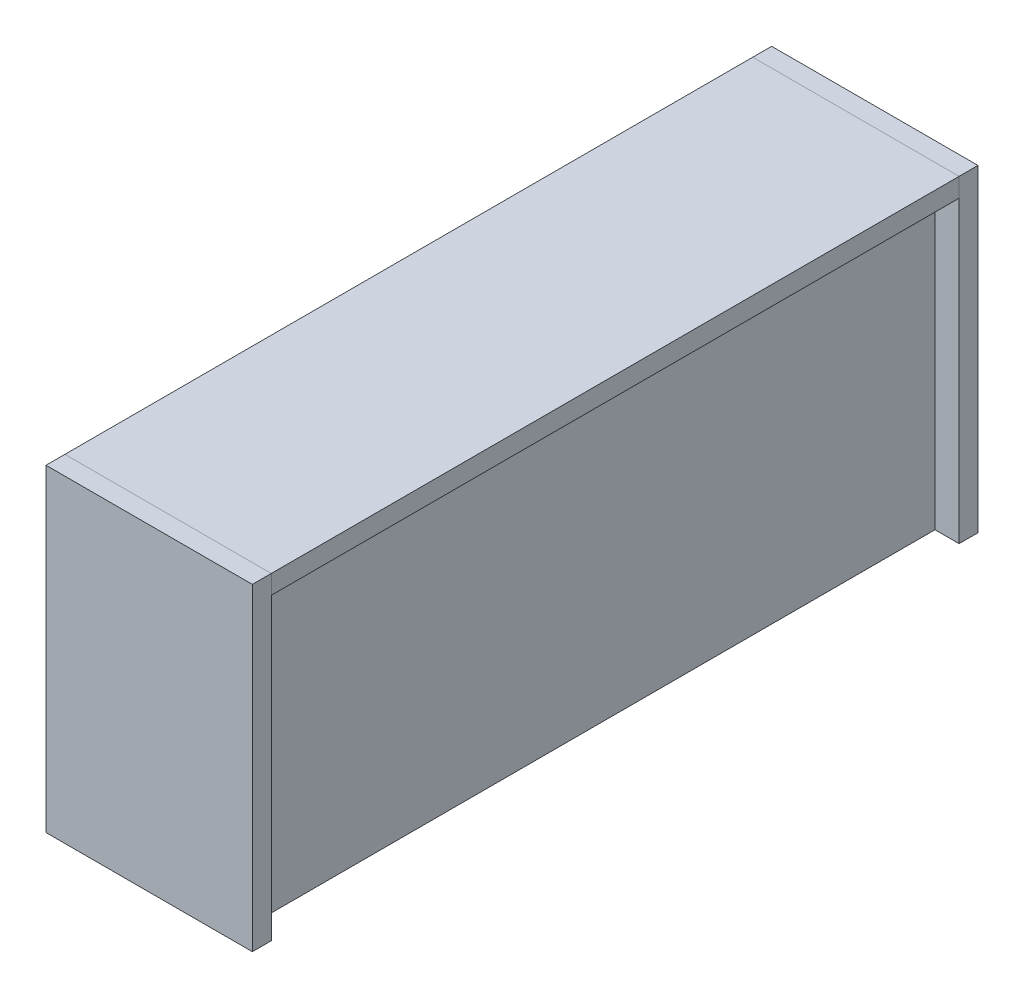
from build123d import *

# Parameters (mm, degrees)
SKIZZE1_W                         = 240
SKIZZE1_H                         = 370
AUFSATZ_LINEAR_AUSTRAGEN1_DEPTH   = 22
SKIZZE2_W                         = 22
SKIZZE2_H                         = 348
AUFSATZ_LINEAR_AUSTRAGEN2_DEPTH   = 800
AUFSATZ_LINEAR_AUSTRAGEN2_2_DEPTH = 800
SKIZZE3_W                         = 240
SKIZZE3_H                         = 22
AUFSATZ_LINEAR_AUSTRAGEN3_DEPTH   = 800
SKIZZE4_W                         = 240
SKIZZE4_H                         = 370
AUFSATZ_LINEAR_AUSTRAGEN4_DEPTH   = 22


with BuildPart() as part:
    # Skizze1 → Aufsatz-Linear austragen1 (new body)
    with BuildSketch(Plane.XY):
        with Locations((0, -185)):
            Rectangle(SKIZZE1_W, SKIZZE1_H)
    extrude(amount=AUFSATZ_LINEAR_AUSTRAGEN1_DEPTH)


with BuildPart() as body_2:
    # Skizze2 → Aufsatz-Linear austragen2 (new body)
    with BuildSketch(Plane.XY.offset(22)):
        with Locations((81, -196)):
            Rectangle(SKIZZE2_W, SKIZZE2_H)
    extrude(amount=AUFSATZ_LINEAR_AUSTRAGEN2_DEPTH)


with BuildPart() as body_3:
    # Skizze2 → Aufsatz-Linear austragen2 2 (new body)
    with BuildSketch(Plane.XY.offset(22)):
        with Locations((-81, -196)):
            Rectangle(SKIZZE2_W, SKIZZE2_H)
    extrude(amount=AUFSATZ_LINEAR_AUSTRAGEN2_2_DEPTH)


with BuildPart() as body_4:
    # Skizze3 → Aufsatz-Linear austragen3 (new body)
    with BuildSketch(Plane.XY.offset(22)):
        with Locations((0, -11)):
            Rectangle(SKIZZE3_W, SKIZZE3_H)
    extrude(amount=AUFSATZ_LINEAR_AUSTRAGEN3_DEPTH)


with BuildPart() as body_5:
    # Skizze4 → Aufsatz-Linear austragen4 (new body)
    with BuildSketch(Plane.XY.offset(822)):
        with Locations((0, -185)):
            Rectangle(SKIZZE4_W, SKIZZE4_H)
    extrude(amount=AUFSATZ_LINEAR_AUSTRAGEN4_DEPTH)


solid = Compound([part.part, body_2.part, body_3.part, body_4.part, body_5.part])
